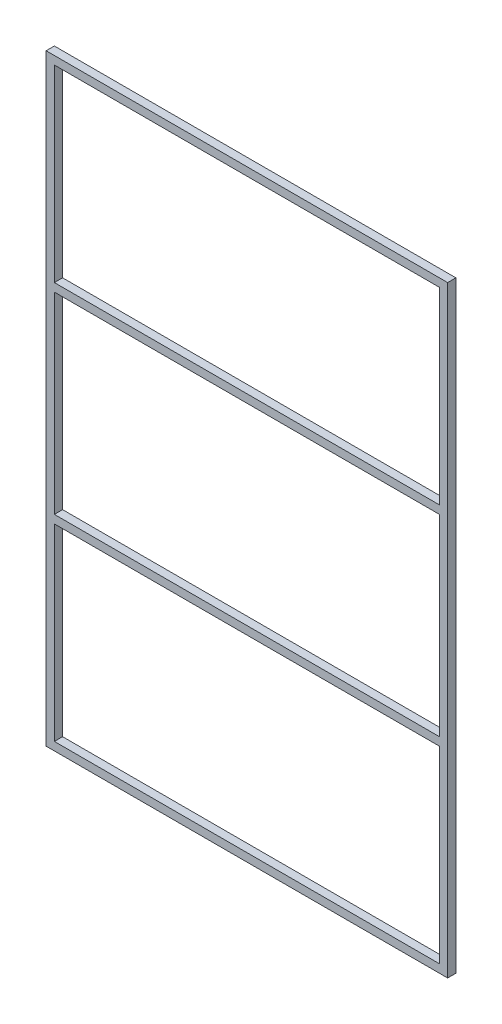
from build123d import *

# Parameters (mm, degrees)
SKETCH1_W           = 2440
SKETCH1_H           = 3660
SKETCH1_W_2         = 2340
SKETCH1_H_2         = 1145
SKETCH1_H_3         = 1170
BOSS_EXTRUDE2_DEPTH = 50


with BuildPart() as part:
    # Sketch1 → Boss-Extrude2 (new body)
    with BuildSketch(Plane.XY):
        with Locations((-227.831325301, -628.373493976)):
            Rectangle(SKETCH1_W, SKETCH1_H)
        with Locations((-227.831325301, -1835.873493976)):
            Rectangle(SKETCH1_W_2, SKETCH1_H_2, mode=Mode.SUBTRACT)
        with Locations((-227.831325301, 579.126506024)):
            Rectangle(SKETCH1_W_2, SKETCH1_H_2, mode=Mode.SUBTRACT)
        with Locations((-227.831325301, -628.373493976)):
            Rectangle(SKETCH1_W_2, SKETCH1_H_3, mode=Mode.SUBTRACT)
    extrude(amount=BOSS_EXTRUDE2_DEPTH)


solid = part.part
